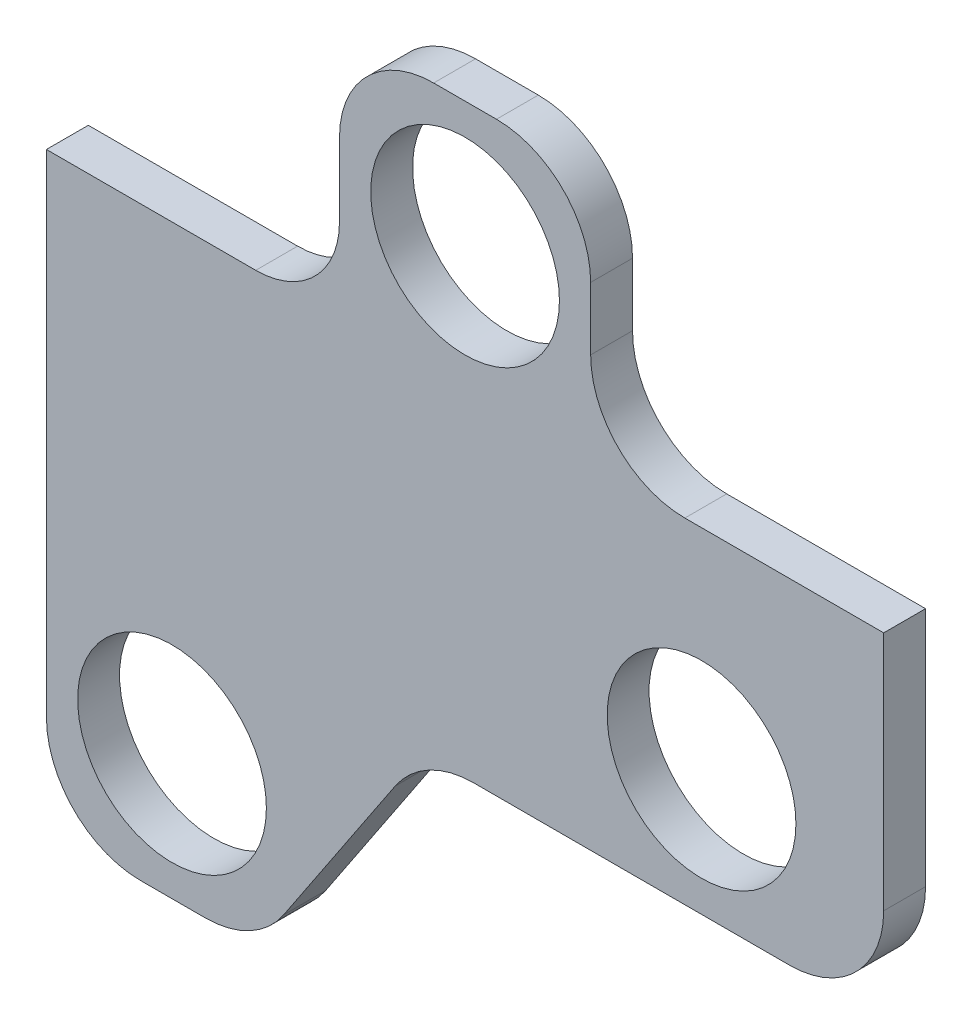
from build123d import *

# Parameters (mm, degrees)
SKETCH1_R           = 14.3129
BOSS_EXTRUDE1_DEPTH = 6.35
FILLET1_R           = 14.2875
SKETCH2_W           = 38.1
SKETCH2_H           = 38.1
BOSS_EXTRUDE2_DEPTH = 6.35
FILLET2_R           = 14.2875
SKETCH3_R           = 14.3129
CUT_EXTRUDE1_DEPTH  = 105.341147205
FILLET3_R           = 12.7


with BuildPart() as part:
    # Sketch1 → Boss-Extrude1 (new body)
    with BuildSketch(Plane.XY):
        Polygon((-6.35, -6.35), (63.5, -6.35), (63.5, 44.45), (-63.5, 44.45), (-63.5, -44.45), (-31.75, -44.45), align=None)
        with Locations((-44.45, -25.4)):
            Circle(SKETCH1_R, mode=Mode.SUBTRACT)
        with Locations((35.871852568, 12.7)):
            Circle(SKETCH1_R, mode=Mode.SUBTRACT)
    extrude(amount=BOSS_EXTRUDE1_DEPTH)

    # Fillet1
    fillet1_edges = [part.edges().sort_by_distance(p)[0] for p in [
        (-31.75, -44.45, 3.175),
        (-63.5, -44.45, 3.175),
        (63.5, -6.35, 3.175),
        (-6.35, -6.35, 3.175),
    ]]
    fillet(fillet1_edges, radius=FILLET1_R)

    # Sketch2 → Boss-Extrude2 (add)
    with BuildSketch(Plane.XY.offset(6.35)):
        with Locations((0, 63.5)):
            Rectangle(SKETCH2_W, SKETCH2_H)
    extrude(amount=-BOSS_EXTRUDE2_DEPTH)

    # Fillet2
    fillet2_edges = [part.edges().sort_by_distance(p)[0] for p in [
        (-19.05, 82.55, 3.175),
        (19.05, 82.55, 3.175),
        (19.05, 44.45, 3.175),
    ]]
    fillet(fillet2_edges, radius=FILLET2_R)

    # Sketch3 → Cut-Extrude1 (cut, through all)
    with BuildSketch(Plane.XY.offset(6.35)):
        with Locations((0, 63.5)):
            Circle(SKETCH3_R)
    extrude(amount=-CUT_EXTRUDE1_DEPTH, mode=Mode.SUBTRACT)

    # Fillet3
    fillet3_edges = [part.edges().sort_by_distance(p)[0] for p in [
        (-19.05, 44.45, 3.175),
    ]]
    fillet(fillet3_edges, radius=FILLET3_R)


solid = part.part
